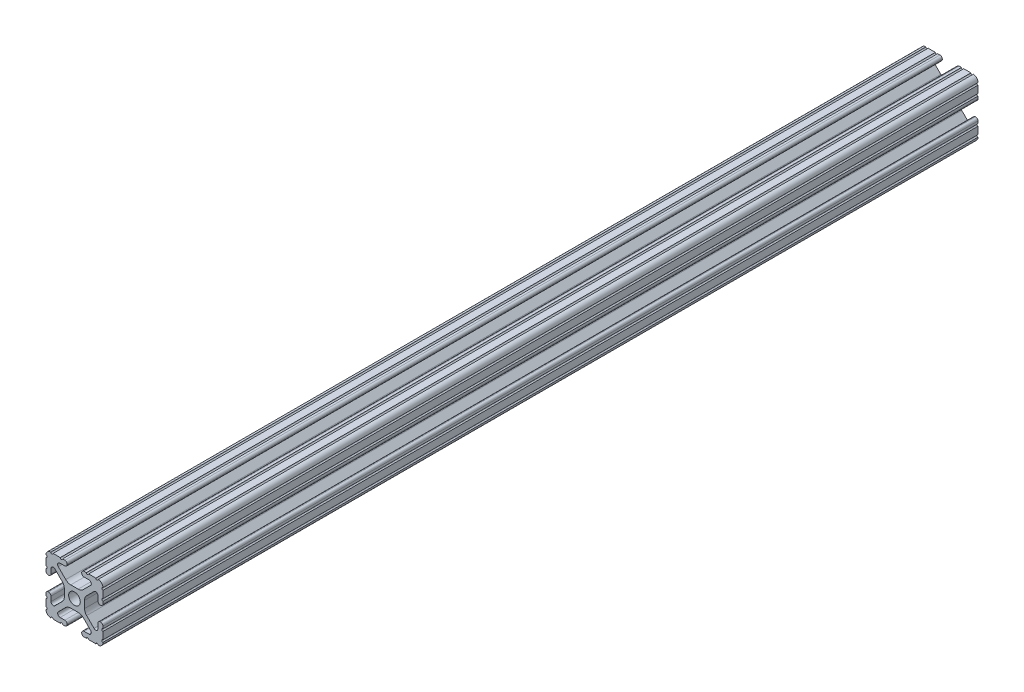
from build123d import *

# Parameters (mm, degrees)
SKETCH1_R           = 2.6035
BOSS_EXTRUDE1_DEPTH = 304.8
SKETCH5_W           = 79.82264729
SKETCH5_H           = 80.595758991
CUT_EXTRUDE4_DEPTH  = 219.075


with BuildPart() as part:
    # Sketch1 → Boss-Extrude1 (new, symmetric)
    with BuildSketch(Plane.XY):
        with BuildLine():
            Line((-7.179650497, -8.645192506), (-3.952270251, -5.423690499))
            ThreePointArc((-3.952270251, -5.423690499), (-2.922936451, -4.736929036), (-1.709253557, -4.4958))
            Line((-1.709253557, -4.4958), (1.709253557, -4.4958))
            ThreePointArc((1.709253557, -4.4958), (2.922936451, -4.736929036), (3.952270251, -5.423690499))
            Line((3.952270251, -5.423690499), (7.179650497, -8.645192506))
            ThreePointArc((7.179650497, -8.645192506), (7.41473083, -9.822813117), (6.416408329, -10.4902))
            Line((6.416408329, -10.4902), (4.287512407, -10.4902))
            ThreePointArc((4.287512407, -10.4902), (3.54574862, -10.79744862), (3.2385, -11.539212407))
            Line((3.2385, -11.539212407), (3.2385, -11.650987593))
            ThreePointArc((3.2385, -11.650987593), (3.54574862, -12.39275138), (4.287512407, -12.7))
            Line((4.287512407, -12.7), (5.317126718, -12.7))
            ThreePointArc((5.317126718, -12.7), (5.825126718, -12.192), (6.333126718, -12.7))
            Line((6.333126718, -12.7), (9.550443118, -12.7))
            ThreePointArc((9.550443118, -12.7), (10.058366869, -12.192000006), (10.566443095, -12.699847501))
            ThreePointArc((10.566443095, -12.699847501), (12.082537762, -12.08250727), (12.699846982, -10.566399977))
            ThreePointArc((12.699846982, -10.566399977), (12.192000006, -10.058323491), (12.7, -9.5504))
            Line((12.7, -9.5504), (12.7, -6.3330836))
            ThreePointArc((12.7, -6.3330836), (12.192, -5.8250836), (12.7, -5.3170836))
            Line((12.7, -5.3170836), (12.7, -4.287469289))
            ThreePointArc((12.7, -4.287469289), (12.39275138, -3.545705502), (11.650987593, -3.238456882))
            Line((11.650987593, -3.238456882), (11.539212407, -3.238456882))
            ThreePointArc((11.539212407, -3.238456882), (10.79744862, -3.545705502), (10.4902, -4.287469289))
            Line((10.4902, -4.287469289), (10.4902, -6.402089023))
            ThreePointArc((10.4902, -6.402089023), (9.856505071, -7.351067942), (8.737131347, -7.129408934))
            Line((8.737131347, -7.129408934), (5.441005833, -3.840816462))
            ThreePointArc((5.441005833, -3.840816462), (4.750877967, -2.809883091), (4.5085, -1.593185507))
            Line((4.5085, -1.593185507), (4.5085, 1.593185507))
            ThreePointArc((4.5085, 1.593185507), (4.750877967, 2.809883091), (5.441005833, 3.840816462))
            Line((5.441005833, 3.840816462), (8.737131347, 7.129408934))
            ThreePointArc((8.737131347, 7.129408934), (9.856505071, 7.351067942), (10.4902, 6.402089023))
            Line((10.4902, 6.402089023), (10.4902, 4.287469289))
            ThreePointArc((10.4902, 4.287469289), (10.79744862, 3.545705502), (11.539212407, 3.238456882))
            Line((11.539212407, 3.238456882), (11.650987593, 3.238456882))
            ThreePointArc((11.650987593, 3.238456882), (12.39275138, 3.545705502), (12.7, 4.287469289))
            Line((12.7, 4.287469289), (12.7, 5.3170836))
            ThreePointArc((12.7, 5.3170836), (12.192, 5.8250836), (12.7, 6.3330836))
            Line((12.7, 6.3330836), (12.7, 9.5504))
            ThreePointArc((12.7, 9.5504), (12.192000006, 10.058323491), (12.699846982, 10.566399977))
            ThreePointArc((12.699846982, 10.566399977), (12.082537762, 12.08250727), (10.566443095, 12.699847501))
            ThreePointArc((10.566443095, 12.699847501), (10.058366869, 12.192000006), (9.550443118, 12.7))
            Line((9.550443118, 12.7), (6.333126718, 12.7))
            ThreePointArc((6.333126718, 12.7), (5.825126718, 12.192), (5.317126718, 12.7))
            Line((5.317126718, 12.7), (4.287512407, 12.7))
            ThreePointArc((4.287512407, 12.7), (3.54574862, 12.39275138), (3.2385, 11.650987593))
            Line((3.2385, 11.650987593), (3.2385, 11.539212407))
            ThreePointArc((3.2385, 11.539212407), (3.54574862, 10.79744862), (4.287512407, 10.4902))
            Line((4.287512407, 10.4902), (6.476788598, 10.4902))
            ThreePointArc((6.476788598, 10.4902), (7.432222385, 9.85140422), (7.207036008, 8.724370562))
            Line((7.207036008, 8.724370562), (3.898272566, 5.423169045))
            ThreePointArc((3.898272566, 5.423169045), (2.869120213, 4.736787962), (1.655778399, 4.4958))
            Line((1.655778399, 4.4958), (-1.655778399, 4.4958))
            ThreePointArc((-1.655778399, 4.4958), (-2.869120213, 4.736787962), (-3.898272566, 5.423169045))
            Line((-3.898272566, 5.423169045), (-7.207036008, 8.724370562))
            ThreePointArc((-7.207036008, 8.724370562), (-7.432222385, 9.85140422), (-6.476788598, 10.4902))
            Line((-6.476788598, 10.4902), (-4.287512407, 10.4902))
            ThreePointArc((-4.287512407, 10.4902), (-3.54574862, 10.79744862), (-3.2385, 11.539212407))
            Line((-3.2385, 11.539212407), (-3.2385, 11.650987593))
            ThreePointArc((-3.2385, 11.650987593), (-3.54574862, 12.39275138), (-4.287512407, 12.7))
            Line((-4.287512407, 12.7), (-5.317126718, 12.7))
            ThreePointArc((-5.317126718, 12.7), (-5.825126718, 12.192), (-6.333126718, 12.7))
            Line((-6.333126718, 12.7), (-9.550443118, 12.7))
            ThreePointArc((-9.550443118, 12.7), (-10.058366869, 12.192000006), (-10.566443095, 12.699847501))
            ThreePointArc((-10.566443095, 12.699847501), (-12.082537762, 12.08250727), (-12.699846982, 10.566399977))
            ThreePointArc((-12.699846982, 10.566399977), (-12.192000006, 10.058323491), (-12.7, 9.5504))
            Line((-12.7, 9.5504), (-12.7, 6.3330836))
            ThreePointArc((-12.7, 6.3330836), (-12.192, 5.8250836), (-12.7, 5.3170836))
            Line((-12.7, 5.3170836), (-12.7, 4.287469289))
            ThreePointArc((-12.7, 4.287469289), (-12.39275138, 3.545705502), (-11.650987593, 3.238456882))
            Line((-11.650987593, 3.238456882), (-11.539212407, 3.238456882))
            ThreePointArc((-11.539212407, 3.238456882), (-10.79744862, 3.545705502), (-10.4902, 4.287469289))
            Line((-10.4902, 4.287469289), (-10.4902, 6.402089023))
            ThreePointArc((-10.4902, 6.402089023), (-9.856505071, 7.351067942), (-8.737131347, 7.129408934))
            Line((-8.737131347, 7.129408934), (-5.441005833, 3.840816462))
            ThreePointArc((-5.441005833, 3.840816462), (-4.750877967, 2.809883091), (-4.5085, 1.593185507))
            Line((-4.5085, 1.593185507), (-4.5085, -1.593185507))
            ThreePointArc((-4.5085, -1.593185507), (-4.750877967, -2.809883091), (-5.441005833, -3.840816462))
            Line((-5.441005833, -3.840816462), (-8.737131347, -7.129408934))
            ThreePointArc((-8.737131347, -7.129408934), (-9.856505071, -7.351067942), (-10.4902, -6.402089023))
            Line((-10.4902, -6.402089023), (-10.4902, -4.287469289))
            ThreePointArc((-10.4902, -4.287469289), (-10.79744862, -3.545705502), (-11.539212407, -3.238456882))
            Line((-11.539212407, -3.238456882), (-11.650987593, -3.238456882))
            ThreePointArc((-11.650987593, -3.238456882), (-12.39275138, -3.545705502), (-12.7, -4.287469289))
            Line((-12.7, -4.287469289), (-12.7, -5.3170836))
            ThreePointArc((-12.7, -5.3170836), (-12.192, -5.8250836), (-12.7, -6.3330836))
            Line((-12.7, -6.3330836), (-12.7, -9.5504))
            ThreePointArc((-12.7, -9.5504), (-12.192000006, -10.058323491), (-12.699846982, -10.566399977))
            ThreePointArc((-12.699846982, -10.566399977), (-12.082537762, -12.08250727), (-10.566443095, -12.699847501))
            ThreePointArc((-10.566443095, -12.699847501), (-10.058366869, -12.192000006), (-9.550443118, -12.7))
            Line((-9.550443118, -12.7), (-6.333126718, -12.7))
            ThreePointArc((-6.333126718, -12.7), (-5.825126718, -12.192), (-5.317126718, -12.7))
            Line((-5.317126718, -12.7), (-4.287512407, -12.7))
            ThreePointArc((-4.287512407, -12.7), (-3.54574862, -12.39275138), (-3.2385, -11.650987593))
            Line((-3.2385, -11.650987593), (-3.2385, -11.539212407))
            ThreePointArc((-3.2385, -11.539212407), (-3.54574862, -10.79744862), (-4.287512407, -10.4902))
            Line((-4.287512407, -10.4902), (-6.416408329, -10.4902))
            ThreePointArc((-6.416408329, -10.4902), (-7.41473083, -9.822813117), (-7.179650497, -8.645192506))
        make_face()
        with Locations(Location((0, 0, 0), (0, 0, 180))):
            Circle(SKETCH1_R, mode=Mode.SUBTRACT)
    extrude(amount=BOSS_EXTRUDE1_DEPTH, both=True)

    # Sketch5 → Cut-Extrude4 (cut)
    with BuildSketch(Plane.XY.offset(304.8)):
        with Locations((6.688981976, -4.120333707)):
            Rectangle(SKETCH5_W, SKETCH5_H)
    extrude(amount=-CUT_EXTRUDE4_DEPTH, mode=Mode.SUBTRACT)


solid = part.part
